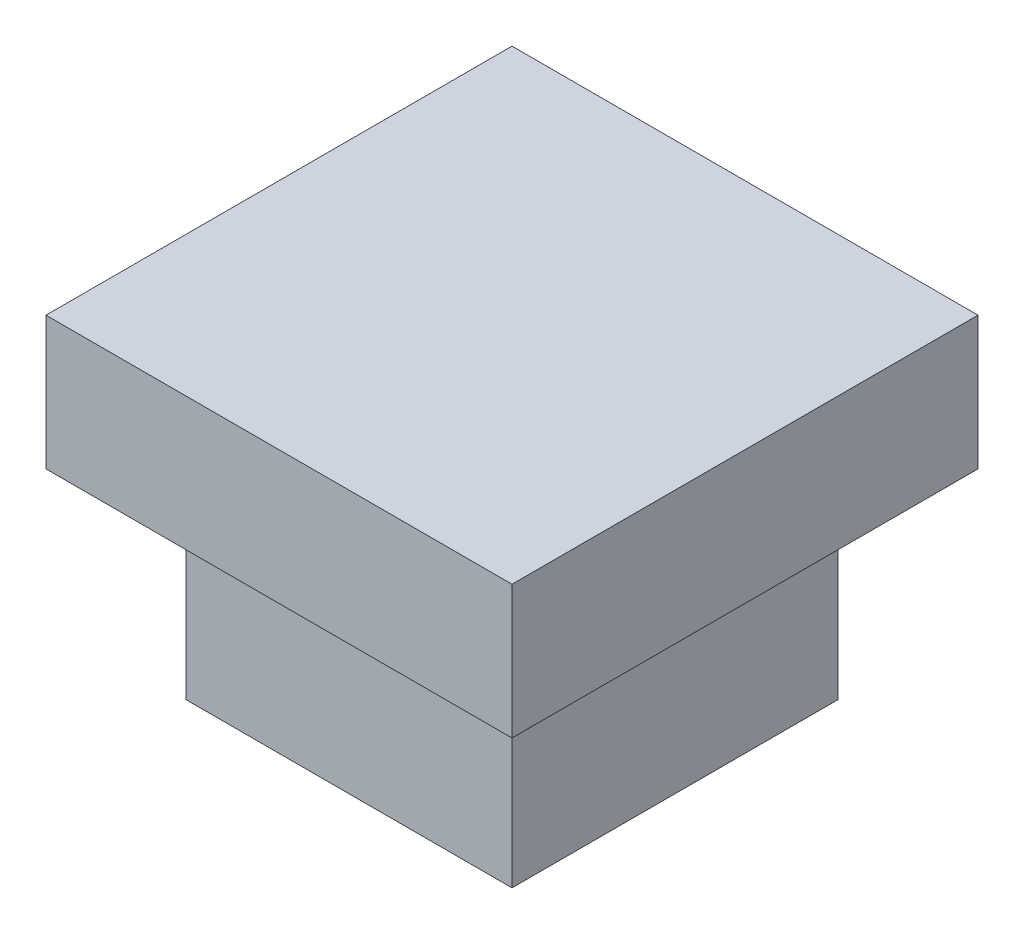
from build123d import *

# Parameters (mm, degrees)
CROQUIS1_W              = 4.9
CROQUIS1_H              = 4.9
SALIENTE_EXTRUIR1_DEPTH = 3
CROQUIS2_W              = 7
CROQUIS2_H              = 7
SALIENTE_EXTRUIR2_DEPTH = 2


with BuildPart() as part:
    # Croquis1 → Saliente-Extruir1 (new body)
    with BuildSketch(Plane(origin=(0, 0, 0), x_dir=(1, 0, 0), z_dir=(0, 1, 0))):
        Rectangle(CROQUIS1_W, CROQUIS1_H)
    extrude(amount=SALIENTE_EXTRUIR1_DEPTH)

    # Croquis2 → Saliente-Extruir2 (add)
    with BuildSketch(Plane(origin=(0, 3, 0), x_dir=(1, 0, 0), z_dir=(0, 1, 0))):
        Rectangle(CROQUIS2_W, CROQUIS2_H)
    extrude(amount=SALIENTE_EXTRUIR2_DEPTH)


solid = part.part
